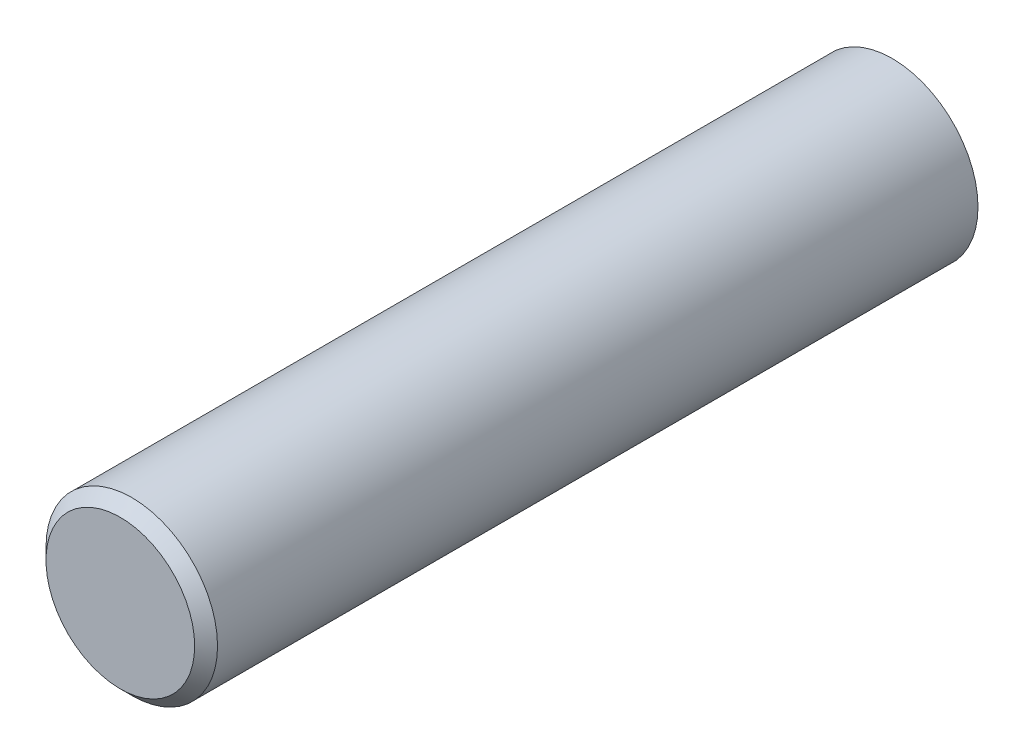
from build123d import *

# Parameters (mm, degrees)
SKETCH1_R           = 1.5
BOSS_EXTRUDE1_DEPTH = 6.75
CHAMFER1_SIZE       = 0.2


with BuildPart() as part:
    # Sketch1 → Boss-Extrude1 (new, symmetric)
    with BuildSketch(Plane.XY):
        Circle(SKETCH1_R)
    extrude(amount=BOSS_EXTRUDE1_DEPTH, both=True)

    # Chamfer1
    chamfer1_edges = [part.edges().sort_by_distance(p)[0] for p in [
        (-1.5, 0, 6.75),
    ]]
    chamfer(chamfer1_edges, length=CHAMFER1_SIZE)


solid = part.part
